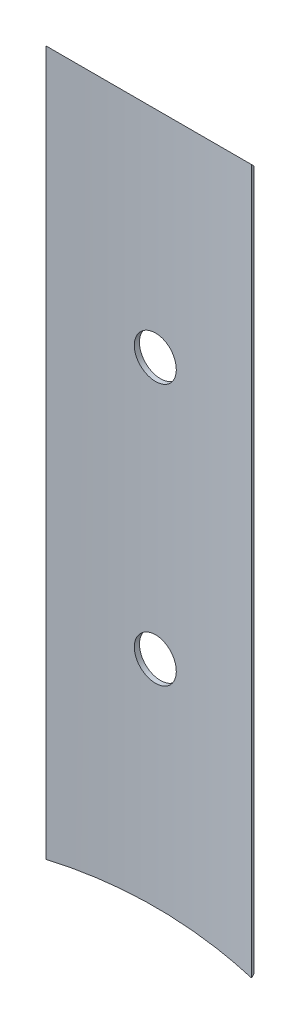
from build123d import *

# Parameters (mm, degrees)
BOSS_EXTRUDE1_DEPTH     = 40
CUT_EXTRUDE1_DEPTH      = 42.496987842
CUT_EXTRUDE1_DEPTH_BACK = 42.496987842
SKETCH6_OUTSIDE_W       = 19.833
SKETCH6_OUTSIDE_H       = 98.596
M4_CLEARANCE_HOLE1_D    = 4.5


with BuildPart() as part:
    # Sketch1 → Boss-Extrude1 (new, symmetric)
    with BuildSketch(Plane(origin=(0, 0, 0), x_dir=(1, 0, 0), z_dir=(0, 1, 0))):
        with BuildLine():
            Line((-9, 1), (9, 1))
            Line((9, 1), (9, 0.5))
            Line((9, 0.5), (9.5, 0))
            Line((9.5, 0), (11, 0))
            Line((11, 0), (11, -0.236956414))
            ThreePointArc((11, -0.236956414), (0, 0.477813564), (-11, -0.236956414))
            Line((-11, -0.236956414), (-11, 0))
            Line((-11, 0), (-9.5, 0))
            Line((-9.5, 0), (-9, 0.5))
            Line((-9, 0.5), (-9, 1))
        make_face()
    extrude(amount=BOSS_EXTRUDE1_DEPTH, both=True)

    # Sketch6 outside → Cut-Extrude1 (cut, two sides: drawn at the far end of the back side and taken through both)
    with BuildSketch(Plane(origin=(0, 0, 0), x_dir=(0, 0, -1), z_dir=(1, 0, 0)).offset(-CUT_EXTRUDE1_DEPTH_BACK)):
        with Locations((0.3815, 0)):
            Rectangle(SKETCH6_OUTSIDE_W, SKETCH6_OUTSIDE_H)
        Polygon((1, -36.5), (1, 36.5), (-0.236956414, 37.736956414), (-0.236956414, -37.736956414), align=None, mode=Mode.SUBTRACT)
    extrude(amount=CUT_EXTRUDE1_DEPTH + CUT_EXTRUDE1_DEPTH_BACK, mode=Mode.SUBTRACT)

    # M4 Clearance Hole1 (through all)
    with Locations(Plane(origin=(0, 0, -1), x_dir=(-1, 0, 0), z_dir=(0, 0, -1))):
        with Locations((0, 14), (0, -14)):
            Hole(M4_CLEARANCE_HOLE1_D / 2)


solid = part.part
